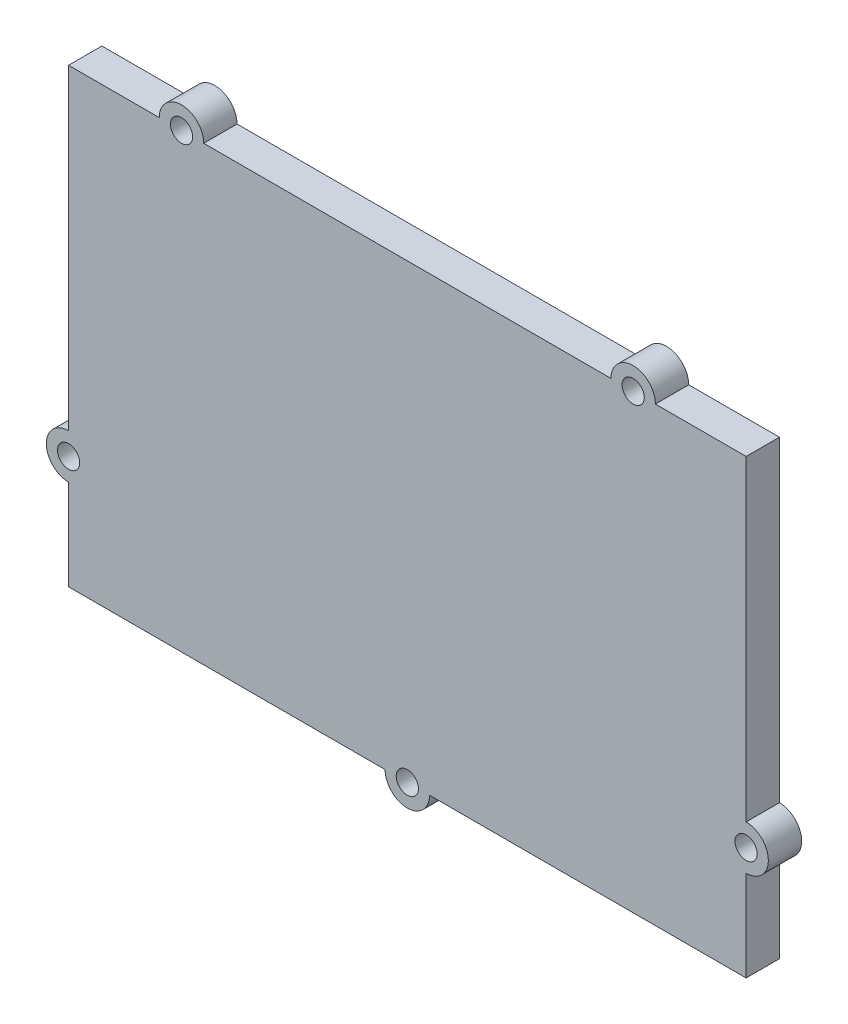
from build123d import *

# Parameters (mm, degrees)
ESQUISSE1_R        = 1
BOSS_EXTRU_2_DEPTH = 3


with BuildPart() as part:
    # Esquisse1 → Boss.-Extru.2 (new body)
    with BuildSketch(Plane.XY):
        with BuildLine():
            Line((30.48, -20.32), (30.48, -12.16))
            ThreePointArc((30.48, -12.16), (32.48, -10.16), (30.48, -8.16))
            Line((30.48, -8.16), (30.48, 20.32))
            Line((30.48, 20.32), (22.32, 20.32))
            ThreePointArc((22.32, 20.32), (20.32, 22.32), (18.32, 20.32))
            Line((18.32, 20.32), (-18.32, 20.32))
            ThreePointArc((-18.32, 20.32), (-20.32, 22.32), (-22.32, 20.32))
            Line((-22.32, 20.32), (-30.48, 20.32))
            Line((-30.48, 20.32), (-30.48, -8.16))
            ThreePointArc((-30.48, -8.16), (-32.48, -10.16), (-30.48, -12.16))
            Line((-30.48, -12.16), (-30.48, -20.32))
            Line((-30.48, -20.32), (-2, -20.32))
            ThreePointArc((-2, -20.32), (0, -22.32), (2, -20.32))
            Line((2, -20.32), (30.48, -20.32))
        make_face()
        with Locations((-30.48, -10.16)):
            Circle(ESQUISSE1_R, mode=Mode.SUBTRACT)
        with Locations((0, -20.32)):
            Circle(ESQUISSE1_R, mode=Mode.SUBTRACT)
        with Locations((30.48, -10.16)):
            Circle(ESQUISSE1_R, mode=Mode.SUBTRACT)
        with Locations((20.32, 20.32)):
            Circle(ESQUISSE1_R, mode=Mode.SUBTRACT)
        with Locations((-20.32, 20.32)):
            Circle(ESQUISSE1_R, mode=Mode.SUBTRACT)
    extrude(amount=BOSS_EXTRU_2_DEPTH)


solid = part.part
